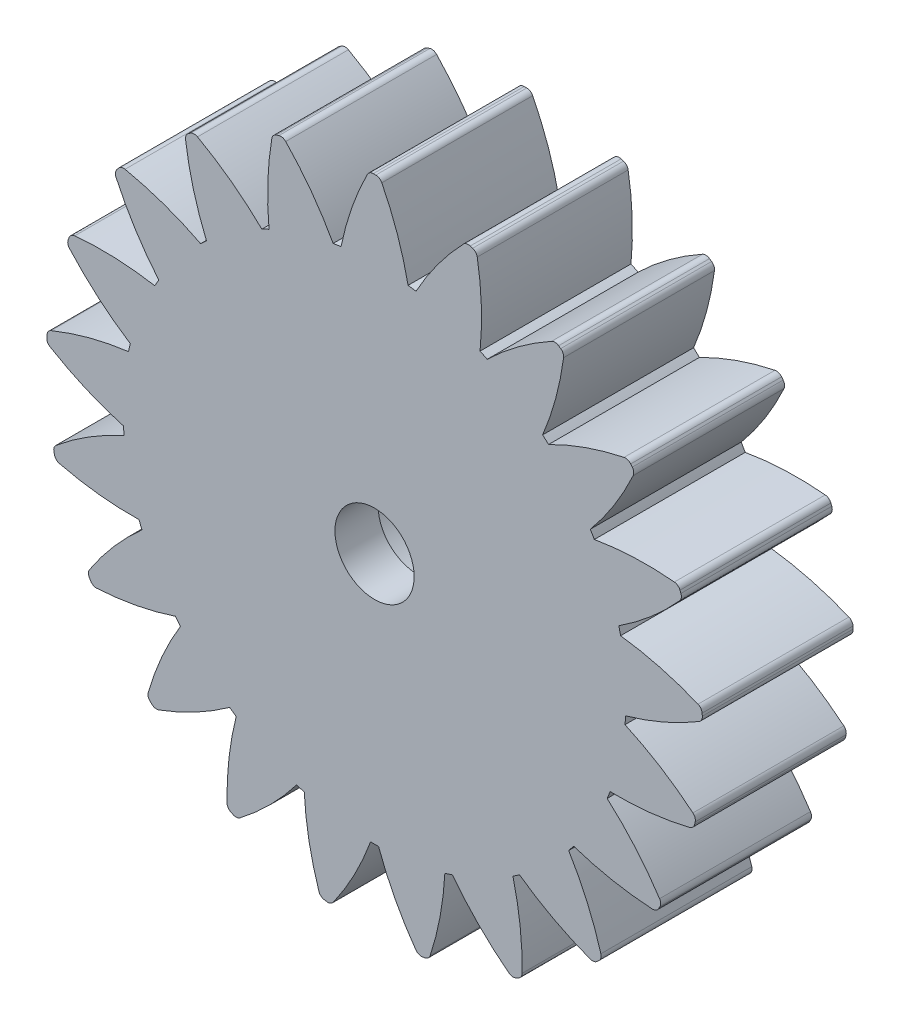
from build123d import *

# Parameters (mm, degrees)
SKETCH2_R           = 9.525
BOSS_EXTRUDE1_DEPTH = 5.08
SKETCH3_R           = 2.8956
CUT_EXTRUDE1_DEPTH  = 5.08
BOSS_EXTRUDE2_START = -5.08
BOSS_EXTRUDE2_DEPTH = 5.08
CIRPATTERN1_COUNT   = 21
SKETCH5_R           = 1.5
BOSS_EXTRUDE3_DEPTH = 0.635
SKETCH6_R           = 2.8956
SKETCH6_R_2         = 1.5
BOSS_EXTRUDE4_DEPTH = 1


with BuildPart() as part:
    # Sketch2 → Boss-Extrude1 (new body)
    with BuildSketch(Plane.XY):
        Circle(SKETCH2_R)
    extrude(amount=BOSS_EXTRUDE1_DEPTH)

    # Sketch3 → Cut-Extrude1 (cut)
    with BuildSketch(Plane.XY.offset(5.08)):
        Circle(SKETCH3_R)
    extrude(amount=-CUT_EXTRUDE1_DEPTH, mode=Mode.SUBTRACT)

    # Sketch4 → Boss-Extrude2 (add)
    with BuildSketch(Plane.XY.offset(5.08).offset(BOSS_EXTRUDE2_START)):
        with BuildLine():
            Line((-0.048062846, 12.446), (0.048062846, 12.446))
            ThreePointArc((0.048062846, 12.446), (0.181205523, 12.408307715), (0.274832832, 12.306417539))
            ThreePointArc((0.274832832, 12.306417539), (0.867958418, 10.906355477), (1.27, 9.439953655))
            ThreePointArc((1.27, 9.439953655), (0, 9.525), (-1.27, 9.439953655))
            ThreePointArc((-1.27, 9.439953655), (-0.867958418, 10.906355477), (-0.274832832, 12.306417539))
            ThreePointArc((-0.274832832, 12.306417539), (-0.181205523, 12.408307715), (-0.048062846, 12.446))
        make_face()
    boss_extrude2 = extrude(amount=BOSS_EXTRUDE2_DEPTH)

    # CirPattern1: Boss-Extrude2 ×21 about axis
    cirpattern1_axis = Axis((0, 0, 0), (0, 0, 1))
    for i in range(1, CIRPATTERN1_COUNT):
        add(boss_extrude2.rotate(cirpattern1_axis, i * 360 / CIRPATTERN1_COUNT))

    # Sketch5 → Boss-Extrude3 (add)
    with BuildSketch(Plane.XY.offset(5.08)):
        with BuildLine():
            Line((-3.622595352, 11.907225913), (-3.714450449, 11.878892368))
            ThreePointArc((-3.714450449, 11.878892368), (-3.830567975, 11.803630152), (-3.890003029, 11.678669538))
            ThreePointArc((-3.890003029, 11.678669538), (-4.044102172, 10.165981469), (-3.996052649, 8.646223929))
            ThreePointArc((-3.996052649, 8.646223929), (-4.132742615, 8.581728467), (-4.268391997, 8.515072211))
            ThreePointArc((-4.268391997, 8.515072211), (-5.426627901, 9.500192168), (-6.7053743, 10.322858191))
            ThreePointArc((-6.7053743, 10.322858191), (-6.840129593, 10.354301663), (-6.971370056, 10.31044255))
            Line((-6.971370056, 10.31044255), (-7.05079283, 10.25629302))
            ThreePointArc((-7.05079283, 10.25629302), (-7.139567652, 10.150148252), (-7.159529385, 10.013220497))
            ThreePointArc((-7.159529385, 10.013220497), (-6.8609097, 8.522315395), (-6.367038484, 7.084239263))
            ThreePointArc((-6.367038484, 7.084239263), (-6.478645327, 6.982319079), (-6.588620912, 6.878640816))
            ThreePointArc((-6.588620912, 6.878640816), (-7.985768849, 7.478598632), (-9.4501892, 7.887798794))
            ThreePointArc((-9.4501892, 7.887798794), (-9.58822582, 7.878125501), (-9.700707936, 7.79753112))
            Line((-9.700707936, 7.79753112), (-9.760641325, 7.722377028))
            ThreePointArc((-9.760641325, 7.722377028), (-9.814185411, 7.594781136), (-9.792900137, 7.458052872))
            ThreePointArc((-9.792900137, 7.458052872), (-9.068095293, 6.121404199), (-8.172285009, 4.892788851))
            ThreePointArc((-8.172285009, 4.892788851), (-8.248891971, 4.7625), (-8.323421944, 4.631011999))
            ThreePointArc((-8.323421944, 4.631011999), (-9.835339189, 4.792498788), (-11.355313319, 4.751873859))
            ThreePointArc((-11.355313319, 4.751873859), (-11.484366105, 4.701943316), (-11.568095346, 4.591774831))
            Line((-11.568095346, 4.591774831), (-11.603214005, 4.502293948))
            ThreePointArc((-11.603214005, 4.502293948), (-11.616769728, 4.364584386), (-11.556128736, 4.240204521))
            ThreePointArc((-11.556128736, 4.240204521), (-10.469540824, 3.176579376), (-9.251388146, 2.266592677))
            ThreePointArc((-9.251388146, 2.266592677), (-9.286188364, 2.119511896), (-9.318650411, 1.971897442))
            ThreePointArc((-9.318650411, 1.971897442), (-10.810996481, 1.680564396), (-12.251468017, 1.193724078))
            ThreePointArc((-12.251468017, 1.193724078), (-12.360070064, 1.107972833), (-12.407606719, 0.978019197))
            Line((-12.407606719, 0.978019197), (-12.414790201, 0.882162292))
            ThreePointArc((-12.414790201, 0.882162292), (-12.387153075, 0.746575161), (-12.292544583, 0.64559539))
            ThreePointArc((-12.292544583, 0.64559539), (-10.940721709, -0.050498465), (-9.508464848, -0.561000202))
            ThreePointArc((-9.508464848, -0.561000202), (-9.498366168, -0.711804141), (-9.485875894, -0.862428855))
            ThreePointArc((-9.485875894, -0.862428855), (-10.826049293, -1.580695518), (-12.059026016, -2.470493325))
            ThreePointArc((-12.059026016, -2.470493325), (-12.137527556, -2.584445899), (-12.144647784, -2.722637734))
            Line((-12.144647784, -2.722637734), (-12.123257806, -2.816353354))
            ThreePointArc((-12.123257806, -2.816353354), (-12.056883512, -2.937770544), (-11.936713899, -3.006377724))
            ThreePointArc((-11.936713899, -3.006377724), (-10.439771457, -3.273089295), (-8.920672721, -3.338745752))
            ThreePointArc((-8.920672721, -3.338745752), (-8.866572456, -3.479873257), (-8.810239675, -3.620124564))
            ThreePointArc((-8.810239675, -3.620124564), (-9.879160115, -4.701503699), (-10.795086635, -5.915196555))
            ThreePointArc((-10.795086635, -5.915196555), (-10.836512461, -6.047225271), (-10.802583598, -6.181376354))
            Line((-10.802583598, -6.181376354), (-10.754520753, -6.264623646))
            ThreePointArc((-10.754520753, -6.264623646), (-10.655306937, -6.361082444), (-10.520253802, -6.391220984))
            ThreePointArc((-10.520253802, -6.391220984), (-9.011201697, -6.204851778), (-7.540239675, -5.81982909))
            ThreePointArc((-7.540239675, -5.81982909), (-7.446944871, -5.938740363), (-7.351774999, -6.056156319))
            ThreePointArc((-7.351774999, -6.056156319), (-8.054464207, -7.404562644), (-8.571956432, -8.834308613))
            ThreePointArc((-8.571956432, -8.834308613), (-8.572625677, -8.97268214), (-8.500662453, -9.090872559))
            Line((-8.500662453, -9.090872559), (-8.430197335, -9.156254634))
            ThreePointArc((-8.430197335, -9.156254634), (-8.306959581, -9.219184253), (-8.169022988, -9.208176213))
            ThreePointArc((-8.169022988, -9.208176213), (-6.781947121, -8.585285951), (-5.489823244, -7.783795073))
            ThreePointArc((-5.489823244, -7.783795073), (-5.365623553, -7.869924325), (-5.240072851, -7.954072009))
            ThreePointArc((-5.240072851, -7.954072009), (-5.514093808, -9.449693703), (-5.587170283, -10.968453581))
            ThreePointArc((-5.587170283, -10.968453581), (-5.547023483, -11.100876824), (-5.443420145, -11.192604843))
            Line((-5.443420145, -11.192604843), (-5.356813889, -11.234312217))
            ThreePointArc((-5.356813889, -11.234312217), (-5.220502412, -11.258121084), (-5.091938631, -11.206944575))
            ThreePointArc((-5.091938631, -11.206944575), (-3.950086781, -10.202879791), (-2.951611926, -9.056136706))
            ThreePointArc((-2.951611926, -9.056136706), (-2.807543036, -9.101830975), (-2.662767235, -9.145233494))
            ThreePointArc((-2.662767235, -9.145233494), (-2.483771976, -10.655178008), (-2.105939535, -12.128003315))
            ThreePointArc((-2.105939535, -12.128003315), (-2.028543909, -12.242709888), (-1.902506069, -12.299825068))
            Line((-1.902506069, -12.299825068), (-1.807454021, -12.314151859))
            ThreePointArc((-1.807454021, -12.314151859), (-1.670180694, -12.296724452), (-1.562413182, -12.209926731))
            ThreePointArc((-1.562413182, -12.209926731), (-0.767243896, -10.913902987), (-0.151136936, -9.52380085))
            ThreePointArc((-0.151136936, -9.52380085), (0, -9.525), (0.151136936, -9.52380085))
            ThreePointArc((0.151136936, -9.52380085), (0.767243896, -10.913902987), (1.562413182, -12.209926731))
            ThreePointArc((1.562413182, -12.209926731), (1.670180694, -12.296724452), (1.807454021, -12.314151859))
            Line((1.807454021, -12.314151859), (1.902506069, -12.299825068))
            ThreePointArc((1.902506069, -12.299825068), (2.028543909, -12.242709888), (2.105939535, -12.128003315))
            ThreePointArc((2.105939535, -12.128003315), (2.483771976, -10.655178008), (2.662767235, -9.145233494))
            ThreePointArc((2.662767235, -9.145233494), (2.807543036, -9.101830975), (2.951611926, -9.056136706))
            ThreePointArc((2.951611926, -9.056136706), (3.950086781, -10.202879791), (5.091938631, -11.206944575))
            ThreePointArc((5.091938631, -11.206944575), (5.220502412, -11.258121084), (5.356813889, -11.234312217))
            Line((5.356813889, -11.234312217), (5.443420145, -11.192604843))
            ThreePointArc((5.443420145, -11.192604843), (5.547023483, -11.100876824), (5.587170283, -10.968453581))
            ThreePointArc((5.587170283, -10.968453581), (5.514093808, -9.449693703), (5.240072851, -7.954072009))
            ThreePointArc((5.240072851, -7.954072009), (5.365623553, -7.869924325), (5.489823244, -7.783795073))
            ThreePointArc((5.489823244, -7.783795073), (6.781947121, -8.585285951), (8.169022988, -9.208176213))
            ThreePointArc((8.169022988, -9.208176213), (8.306959581, -9.219184253), (8.430197335, -9.156254634))
            Line((8.430197335, -9.156254634), (8.500662453, -9.090872559))
            ThreePointArc((8.500662453, -9.090872559), (8.572625677, -8.97268214), (8.571956432, -8.834308613))
            ThreePointArc((8.571956432, -8.834308613), (8.054464207, -7.404562644), (7.351774999, -6.056156319))
            ThreePointArc((7.351774999, -6.056156319), (7.446944871, -5.938740363), (7.540239675, -5.81982909))
            ThreePointArc((7.540239675, -5.81982909), (9.011201697, -6.204851778), (10.520253802, -6.391220984))
            ThreePointArc((10.520253802, -6.391220984), (10.655306937, -6.361082444), (10.754520753, -6.264623646))
            Line((10.754520753, -6.264623646), (10.802583598, -6.181376354))
            ThreePointArc((10.802583598, -6.181376354), (10.836512461, -6.047225271), (10.795086635, -5.915196555))
            ThreePointArc((10.795086635, -5.915196555), (9.879160115, -4.701503699), (8.810239675, -3.620124564))
            ThreePointArc((8.810239675, -3.620124564), (8.866572456, -3.479873257), (8.920672721, -3.338745752))
            ThreePointArc((8.920672721, -3.338745752), (10.439771457, -3.273089295), (11.936713899, -3.006377724))
            ThreePointArc((11.936713899, -3.006377724), (12.056883512, -2.937770544), (12.123257806, -2.816353354))
            Line((12.123257806, -2.816353354), (12.144647784, -2.722637734))
            ThreePointArc((12.144647784, -2.722637734), (12.137527556, -2.584445899), (12.059026016, -2.470493325))
            ThreePointArc((12.059026016, -2.470493325), (10.826049293, -1.580695518), (9.485875894, -0.862428855))
            ThreePointArc((9.485875894, -0.862428855), (9.498366168, -0.711804141), (9.508464848, -0.561000202))
            ThreePointArc((9.508464848, -0.561000202), (10.940721709, -0.050498465), (12.292544583, 0.64559539))
            ThreePointArc((12.292544583, 0.64559539), (12.387153075, 0.746575161), (12.414790201, 0.882162292))
            Line((12.414790201, 0.882162292), (12.407606719, 0.978019197))
            ThreePointArc((12.407606719, 0.978019197), (12.360070064, 1.107972833), (12.251468017, 1.193724078))
            ThreePointArc((12.251468017, 1.193724078), (10.810996481, 1.680564396), (9.318650411, 1.971897442))
            ThreePointArc((9.318650411, 1.971897442), (9.286188364, 2.119511896), (9.251388146, 2.266592677))
            ThreePointArc((9.251388146, 2.266592677), (10.469540824, 3.176579376), (11.556128736, 4.240204521))
            ThreePointArc((11.556128736, 4.240204521), (11.616769728, 4.364584386), (11.603214005, 4.502293948))
            Line((11.603214005, 4.502293948), (11.568095346, 4.591774831))
            ThreePointArc((11.568095346, 4.591774831), (11.484366105, 4.701943316), (11.355313319, 4.751873859))
            ThreePointArc((11.355313319, 4.751873859), (9.835339189, 4.792498788), (8.323421944, 4.631011999))
            ThreePointArc((8.323421944, 4.631011999), (8.248891971, 4.7625), (8.172285009, 4.892788851))
            ThreePointArc((8.172285009, 4.892788851), (9.068095293, 6.121404199), (9.792900137, 7.458052872))
            ThreePointArc((9.792900137, 7.458052872), (9.814185411, 7.594781136), (9.760641325, 7.722377028))
            Line((9.760641325, 7.722377028), (9.700707936, 7.79753112))
            ThreePointArc((9.700707936, 7.79753112), (9.58822582, 7.878125501), (9.4501892, 7.887798794))
            ThreePointArc((9.4501892, 7.887798794), (7.985768849, 7.478598632), (6.588620912, 6.878640816))
            ThreePointArc((6.588620912, 6.878640816), (6.478645327, 6.982319079), (6.367038484, 7.084239263))
            ThreePointArc((6.367038484, 7.084239263), (6.8609097, 8.522315395), (7.159529385, 10.013220497))
            ThreePointArc((7.159529385, 10.013220497), (7.139567652, 10.150148252), (7.05079283, 10.25629302))
            Line((7.05079283, 10.25629302), (6.971370056, 10.31044255))
            ThreePointArc((6.971370056, 10.31044255), (6.840129593, 10.354301663), (6.7053743, 10.322858191))
            ThreePointArc((6.7053743, 10.322858191), (5.426627901, 9.500192168), (4.268391997, 8.515072211))
            ThreePointArc((4.268391997, 8.515072211), (4.132742615, 8.581728467), (3.996052649, 8.646223929))
            ThreePointArc((3.996052649, 8.646223929), (4.044102172, 10.165981469), (3.890003029, 11.678669538))
            ThreePointArc((3.890003029, 11.678669538), (3.830567975, 11.803630152), (3.714450449, 11.878892368))
            Line((3.714450449, 11.878892368), (3.622595352, 11.907225913))
            ThreePointArc((3.622595352, 11.907225913), (3.484257834, 11.910452684), (3.364757467, 11.840686337))
            ThreePointArc((3.364757467, 11.840686337), (2.38530725, 10.677651939), (1.568897723, 9.394902072))
            ThreePointArc((1.568897723, 9.394902072), (1.419627585, 9.41861362), (1.27, 9.439953655))
            ThreePointArc((1.27, 9.439953655), (0.867958418, 10.906355477), (0.274832832, 12.306417539))
            ThreePointArc((0.274832832, 12.306417539), (0.181205523, 12.408307715), (0.048062846, 12.446))
            Line((0.048062846, 12.446), (-0.048062846, 12.446))
            ThreePointArc((-0.048062846, 12.446), (-0.181205523, 12.408307715), (-0.274832832, 12.306417539))
            ThreePointArc((-0.274832832, 12.306417539), (-0.867958418, 10.906355477), (-1.27, 9.439953655))
            ThreePointArc((-1.27, 9.439953655), (-1.419627585, 9.41861362), (-1.568897723, 9.394902072))
            ThreePointArc((-1.568897723, 9.394902072), (-2.38530725, 10.677651939), (-3.364757467, 11.840686337))
            ThreePointArc((-3.364757467, 11.840686337), (-3.484257834, 11.910452684), (-3.622595352, 11.907225913))
        make_face()
        Circle(SKETCH5_R, mode=Mode.SUBTRACT)
    extrude(amount=BOSS_EXTRUDE3_DEPTH)

    # Sketch6 → Boss-Extrude4 (add)
    with BuildSketch(Plane(origin=(0, 0, 5.08), x_dir=(-1, 0, 0), z_dir=(0, 0, -1))):
        with Locations(Location((0, 0, 0), (0, 0, 180))):
            Circle(SKETCH6_R)
        Circle(SKETCH6_R_2, mode=Mode.SUBTRACT)
    extrude(amount=BOSS_EXTRUDE4_DEPTH)


solid = part.part
